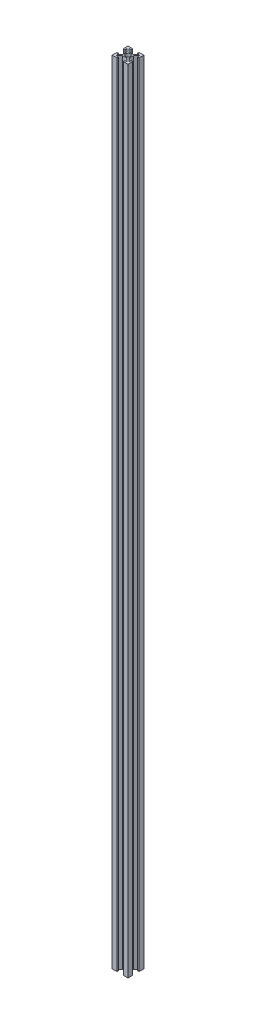
from build123d import *

# Parameters (mm, degrees)
F_2020_SKETCH_R     = 3
BOSS_EXTRUDE1_DEPTH = 1000


with BuildPart() as part:
    # 2020 sketch → Boss-Extrude1 (new body)
    with BuildSketch(Plane(origin=(0, 0, 0), x_dir=(1, 0, 0), z_dir=(0, 1, 0))):
        Polygon((-4, 10), (-4, 8), (-7, 8), (-3, 4), (3, 4), (7, 8), (4, 8), (4, 10), (10, 10), (10, 4), (8, 4), (8, 7), (4, 3), (4, -3), (8, -7), (8, -4), (10, -4), (10, -10), (4, -10), (4, -8), (7, -8), (3, -4), (-3, -4), (-7, -8), (-4, -8), (-4, -10), (-10, -10), (-10, -4), (-8, -4), (-8, -7), (-4, -3), (-4, 3), (-8, 7), (-8, 4), (-10, 4), (-10, 10), align=None)
        with Locations(Location((0, 0, 0), (0, 0, 270))):
            Circle(F_2020_SKETCH_R, mode=Mode.SUBTRACT)
    extrude(amount=BOSS_EXTRUDE1_DEPTH)


solid = part.part
